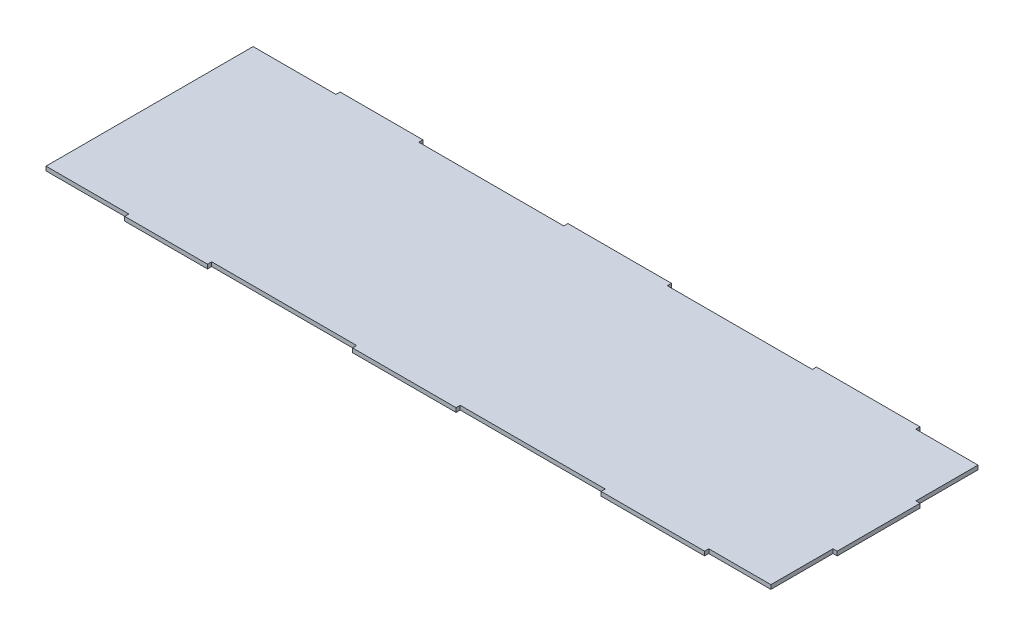
from build123d import *

# Parameters (mm, degrees)
SKETCH_1_W      = 40
SKETCH_1_H      = 2
SKETCH_1_W_2    = 50
SKETCH_1_W_3    = 350
SKETCH_1_H_2    = 100
EXTRUDE_1_DEPTH = 2
SKETCH_2_W      = 2
SKETCH_2_H      = 40
EXTRUDE_2_DEPTH = 2


with BuildPart() as part:
    # 草图1 → 凸台-拉伸1 (new body)
    with BuildSketch(Plane(origin=(0, 0, 0), x_dir=(1, 0, 0), z_dir=(0, 1, 0))):
        with Locations((60, 51)):
            Rectangle(SKETCH_1_W, SKETCH_1_H)
        with Locations((60, -51)):
            Rectangle(SKETCH_1_W, SKETCH_1_H)
        with Locations((175, 51)):
            Rectangle(SKETCH_1_W_2, SKETCH_1_H)
        with Locations((175, -51)):
            Rectangle(SKETCH_1_W_2, SKETCH_1_H)
        with Locations((295, 51)):
            Rectangle(SKETCH_1_W_2, SKETCH_1_H)
        with Locations((295, -51)):
            Rectangle(SKETCH_1_W_2, SKETCH_1_H)
        with Locations((175, 0)):
            Rectangle(SKETCH_1_W_3, SKETCH_1_H_2)
    extrude(amount=EXTRUDE_1_DEPTH)

    # 草图2 → 凸台-拉伸2 (add)
    with BuildSketch(Plane(origin=(0, 0, 0), x_dir=(1, 0, 0), z_dir=(0, 1, 0))):
        with Locations((351, 0)):
            Rectangle(SKETCH_2_W, SKETCH_2_H)
    extrude(amount=EXTRUDE_2_DEPTH)


solid = part.part
